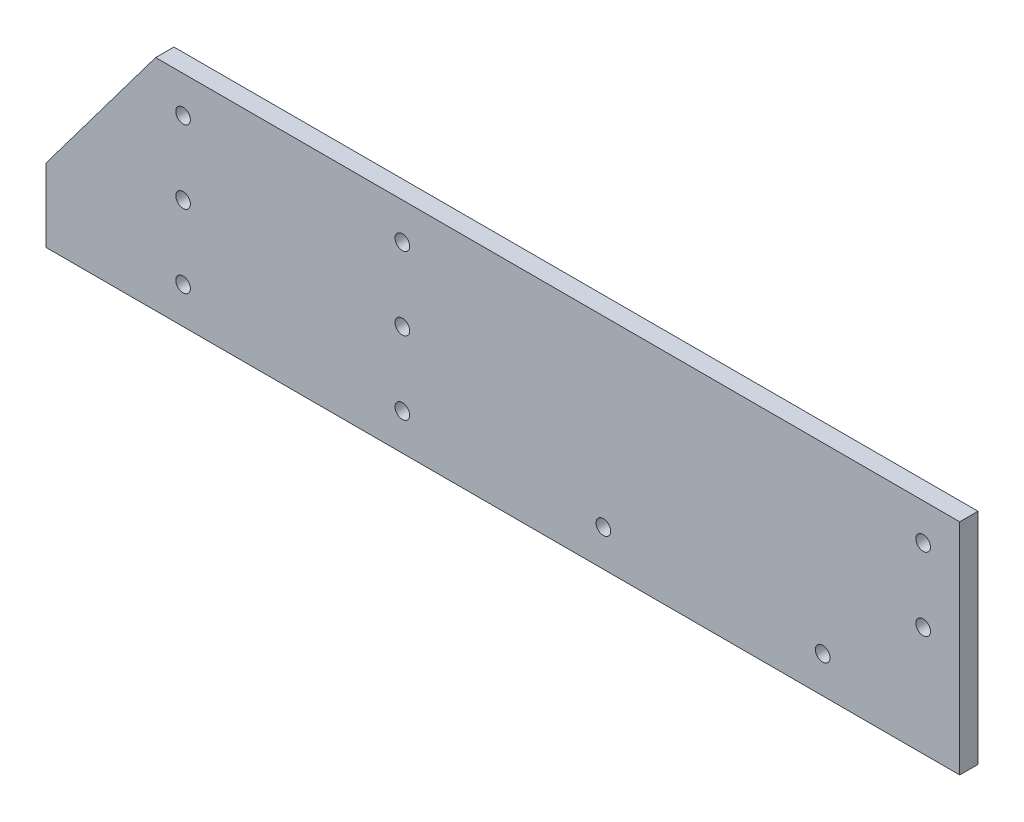
from build123d import *

# Parameters (mm, degrees)
ESQUISSE1_W                  = 250
ESQUISSE1_H                  = 60
BOSS_EXTRU_1_DEPTH           = 5
ESQUISSE2_R                  = 2
ENL_V_MAT_EXTRU_1_DEPTH      = 5
ENL_V_MAT_EXTRU_2_DEPTH      = 258.147817412
ENL_V_MAT_EXTRU_2_DEPTH_BACK = 258.147817412


with BuildPart() as part:
    # Esquisse1 → Boss.-Extru.1 (new body)
    with BuildSketch(Plane.XY):
        with Locations((125, 30)):
            Rectangle(ESQUISSE1_W, ESQUISSE1_H)
    extrude(amount=BOSS_EXTRU_1_DEPTH)

    # Esquisse2 → Enlèv. mat.-Extru.1 (cut)
    with BuildSketch(Plane.XY.offset(5)):
        with Locations((37.5, 10)):
            Circle(ESQUISSE2_R)
        with Locations((97.5, 10)):
            Circle(ESQUISSE2_R)
        with Locations(Location((152.5, 10, 0), (0, 0, 180))):
            Circle(ESQUISSE2_R)
        with Locations(Location((212.5, 10, 0), (0, 0, 180))):
            Circle(ESQUISSE2_R)
        with Locations((240, 50)):
            Circle(ESQUISSE2_R)
        with Locations((240, 30)):
            Circle(ESQUISSE2_R)
        with Locations((37.5, 30)):
            Circle(ESQUISSE2_R)
        with Locations((37.5, 50)):
            Circle(ESQUISSE2_R)
        with Locations(Location((97.5, 50, 0), (0, 0, 180))):
            Circle(ESQUISSE2_R)
        with Locations(Location((97.5, 30, 0), (0, 0, 180))):
            Circle(ESQUISSE2_R)
    extrude(amount=-ENL_V_MAT_EXTRU_1_DEPTH, mode=Mode.SUBTRACT)

    # Esquisse3 → Enlèv. mat.-Extru.2 (cut, two sides: drawn at the far end of the back side and taken through both)
    with BuildSketch(Plane.XY.offset(5).offset(-ENL_V_MAT_EXTRU_2_DEPTH_BACK)):
        Polygon((0, 20), (30, 60), (0, 60), align=None)
    extrude(amount=ENL_V_MAT_EXTRU_2_DEPTH + ENL_V_MAT_EXTRU_2_DEPTH_BACK, mode=Mode.SUBTRACT)


solid = part.part
